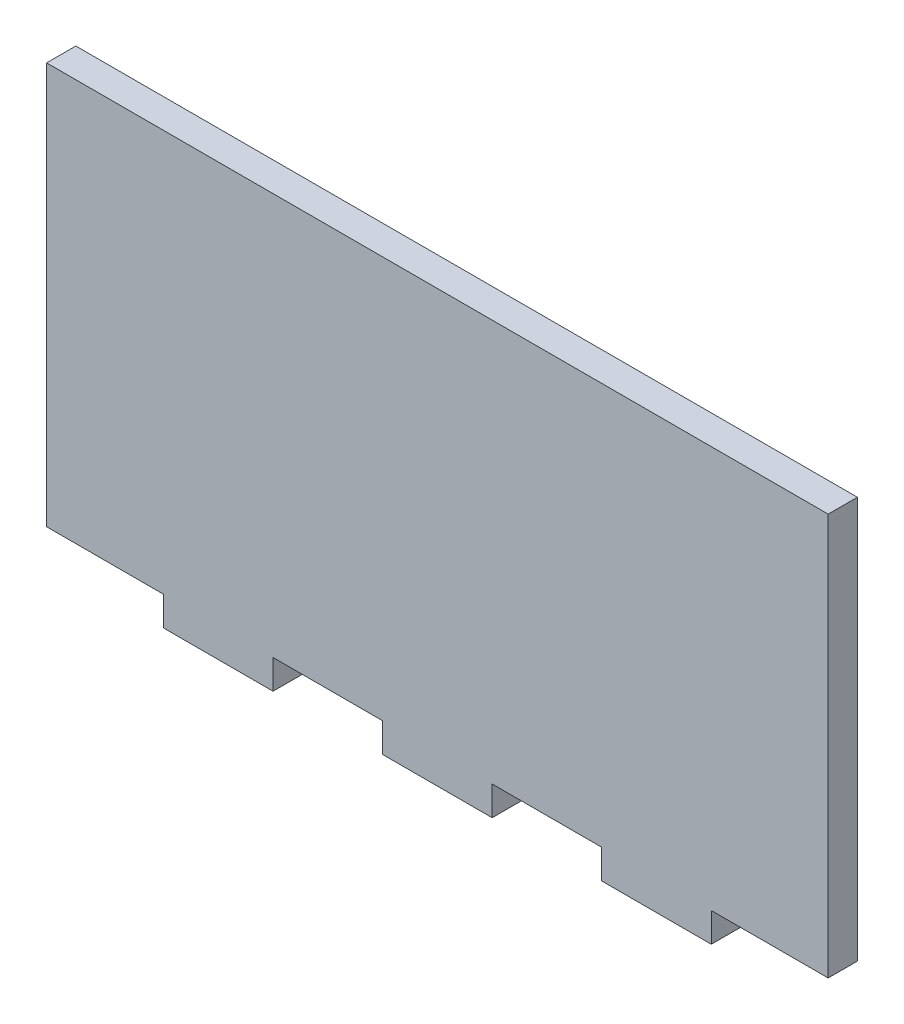
from build123d import *

# Parameters (mm, degrees)
SKETCH1_W           = 107
SKETCH1_H           = 4
BOSS_EXTRUDE1_DEPTH = 55
SKETCH2_W           = 15
SKETCH2_H           = 4
BOSS_EXTRUDE2_DEPTH = 4


with BuildPart() as part:
    # Sketch1 → Boss-Extrude1 (new body)
    with BuildSketch(Plane(origin=(0, 0, 0), x_dir=(1, 0, 0), z_dir=(0, 1, 0))):
        Rectangle(SKETCH1_W, SKETCH1_H)
    extrude(amount=BOSS_EXTRUDE1_DEPTH)

    # Sketch2 → Boss-Extrude2 (add)
    with BuildSketch(Plane.XZ):
        with Locations((-30, 0)):
            Rectangle(SKETCH2_W, SKETCH2_H)
        Rectangle(SKETCH2_W, SKETCH2_H)
        with Locations((30, 0)):
            Rectangle(SKETCH2_W, SKETCH2_H)
    extrude(amount=BOSS_EXTRUDE2_DEPTH)


solid = part.part
